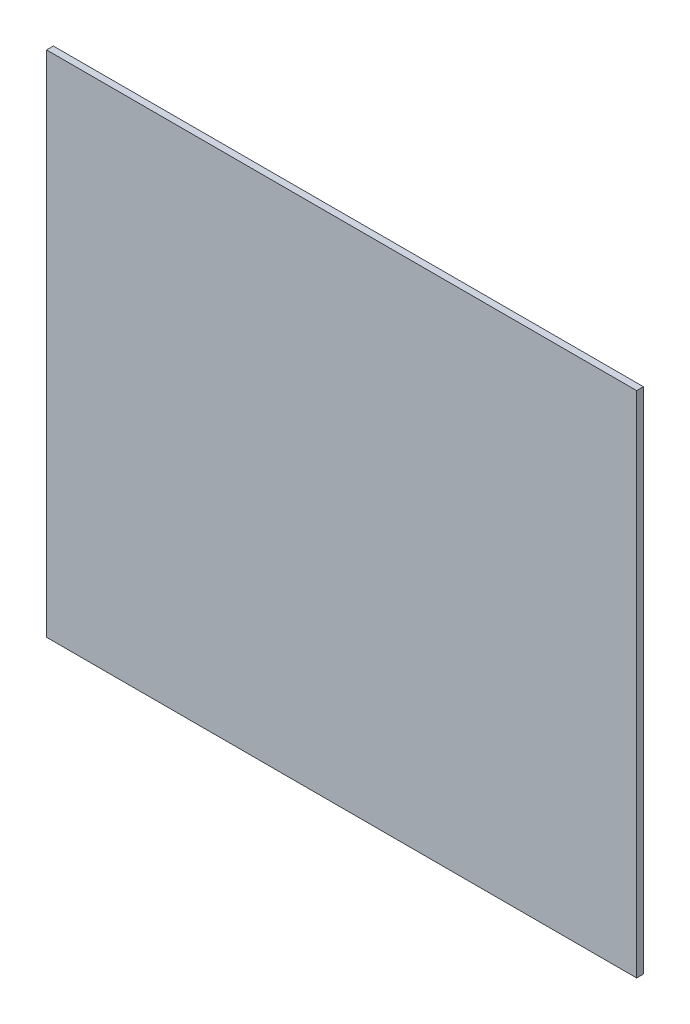
from build123d import *

# Parameters (mm, degrees)
ESQUISSE1_W        = 87
ESQUISSE1_H        = 75
BOSS_EXTRU_1_DEPTH = 1
ESQUISSE2_W        = 10
ESQUISSE2_H        = 20
BOSS_EXTRU_2_DEPTH = 5


with BuildPart() as part:
    # Esquisse1 → Boss.-Extru.1 (new body)
    with BuildSketch(Plane.XY):
        with Locations((10.327168808, -6.216535433)):
            Rectangle(ESQUISSE1_W, ESQUISSE1_H)
    extrude(amount=BOSS_EXTRU_1_DEPTH)

    # Esquisse2 → Boss.-Extru.2 (add)
    with BuildSketch(Plane.ZY.offset(33.172831192)):
        with Locations((-4, -6.216535433)):
            Rectangle(ESQUISSE2_W, ESQUISSE2_H)
    extrude(amount=-BOSS_EXTRU_2_DEPTH)


solid = part.part
